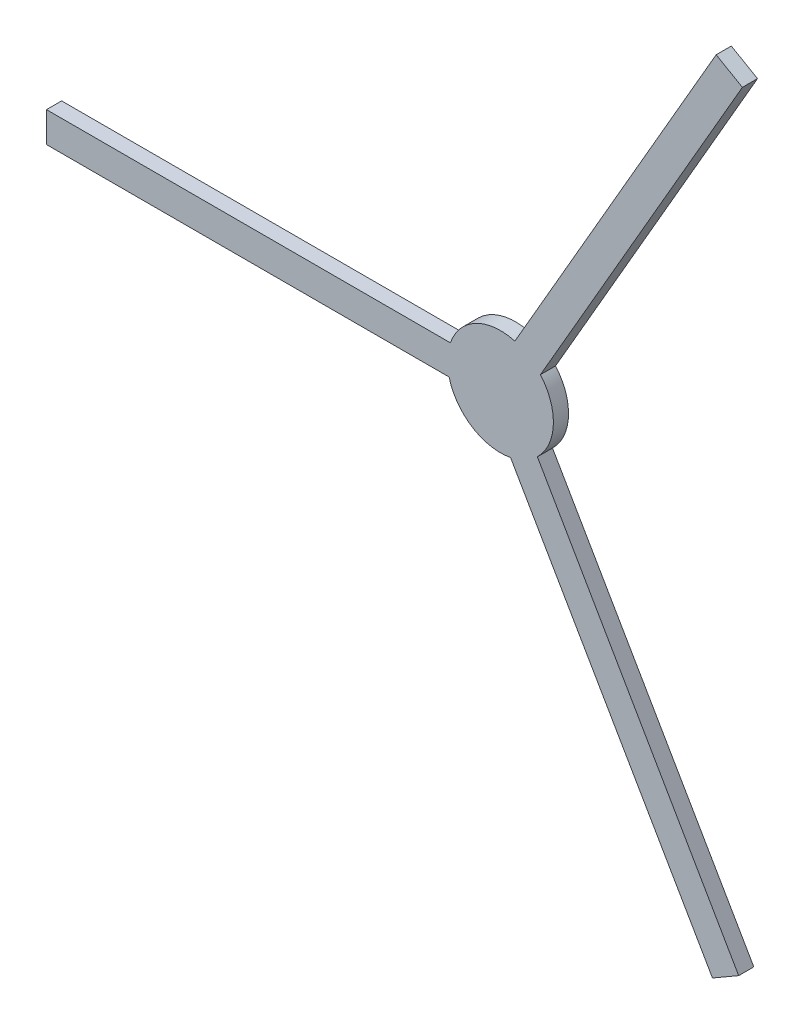
from build123d import *

# Parameters (mm, degrees)
BOSS_EXTRUDE3_DEPTH = 10


with BuildPart() as part:
    # Sketch1 → Boss-Extrude3 (new body)
    with BuildSketch(Plane.XY):
        with BuildLine():
            Line((26.427130678, 22.947914156), (159.883609697, 254.101316416))
            Line((159.883609697, 254.101316416), (142.563101621, 264.101316416))
            Line((142.563101621, 264.101316416), (9.528188737, 33.67808812))
            ThreePointArc((9.528188737, 33.67808812), (-16.207799868, 31.021077084), (-33.087041962, 11.412609438))
            Line((-33.087041962, 11.412609438), (-300, 11.412609438))
            Line((-300, 11.412609438), (-300, -8.587390562))
            Line((-300, -8.587390562), (-33.930174231, -8.587390562))
            ThreePointArc((-33.930174231, -8.587390562), (-18.761140874, -29.546904967), (6.659911284, -34.360523595))
            Line((6.659911284, -34.360523595), (140.116390303, -265.513925854))
            Line((140.116390303, -265.513925854), (157.436898379, -255.513925854))
            Line((157.436898379, -255.513925854), (24.401985494, -25.090697558))
            ThreePointArc((24.401985494, -25.090697558), (34.968940741, -1.474172117), (26.427130678, 22.947914156))
        make_face()
    extrude(amount=BOSS_EXTRUDE3_DEPTH)


solid = part.part
